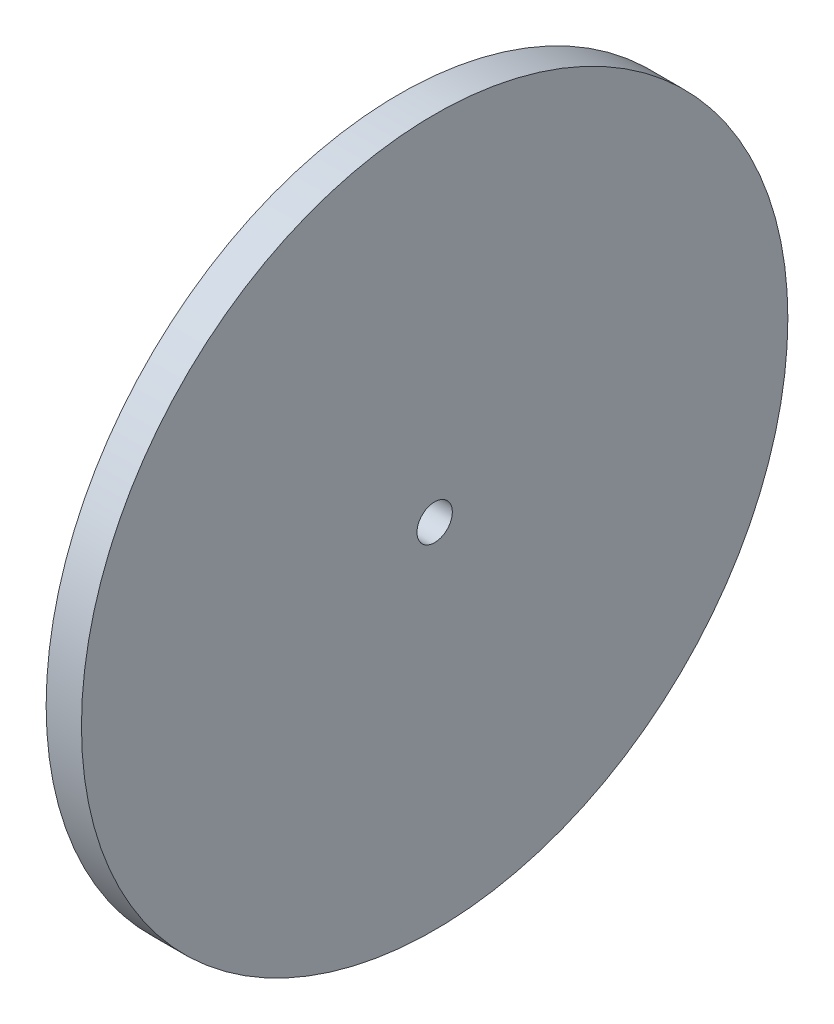
from build123d import *

# Parameters (mm, degrees)
SKETCH1_R           = 63.5
SKETCH1_R_2         = 3.175
BOSS_EXTRUDE1_DEPTH = 6.35


with BuildPart() as part:
    # Sketch1 → Boss-Extrude1 (new body)
    with BuildSketch(Plane(origin=(0, 0, 0), x_dir=(0, 0, -1), z_dir=(1, 0, 0))):
        Circle(SKETCH1_R)
        Circle(SKETCH1_R_2, mode=Mode.SUBTRACT)
    extrude(amount=BOSS_EXTRUDE1_DEPTH)


solid = part.part
